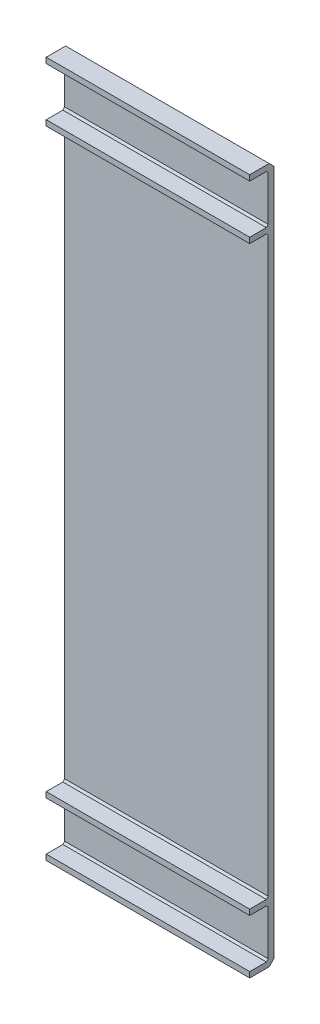
from build123d import *

# Parameters (mm, degrees)
CROQUIS1_W              = 150.4
CROQUIS1_H              = 44
SALIENTE_EXTRUIR1_DEPTH = 1.2
CROQUIS2_W              = 44
CROQUIS2_H              = 1.2
SALIENTE_EXTRUIR2_DEPTH = 4
CHAFL_N1_SIZE           = 0.4
CHAFL_N2_SIZE           = 1


with BuildPart() as part:
    # Croquis1 → Saliente-Extruir1 (new body)
    with BuildSketch(Plane(origin=(0, 0, 0), x_dir=(0, 1, 0), z_dir=(0, 0, 1))):
        Rectangle(CROQUIS1_W, CROQUIS1_H)
    extrude(amount=SALIENTE_EXTRUIR1_DEPTH)

    # Croquis2 → Saliente-Extruir2 (add)
    with BuildSketch(Plane.XY.offset(1.2)):
        with Locations((0, 74.6)):
            Rectangle(CROQUIS2_W, CROQUIS2_H)
        with Locations((0, -74.6)):
            Rectangle(CROQUIS2_W, CROQUIS2_H)
        with Locations((0, -62.9)):
            Rectangle(CROQUIS2_W, CROQUIS2_H)
        with Locations((0, 62.9)):
            Rectangle(CROQUIS2_W, CROQUIS2_H)
    extrude(amount=SALIENTE_EXTRUIR2_DEPTH)

    # Chaflán1
    chafl_n1_edges = [part.edges().sort_by_distance(p)[0] for p in [
        (0, 74, 1.2),
        (0, -74, 1.2),
        (0, -63.5, 1.2),
        (0, -62.3, 1.2),
        (0, 62.3, 1.2),
        (0, 63.5, 1.2),
    ]]
    chamfer(chafl_n1_edges, length=CHAFL_N1_SIZE)

    # Chaflán2
    chafl_n2_edges = [part.edges().sort_by_distance(p)[0] for p in [
        (0, -75.2, 0),
        (0, 75.2, 0),
    ]]
    chamfer(chafl_n2_edges, length=CHAFL_N2_SIZE)


solid = part.part
